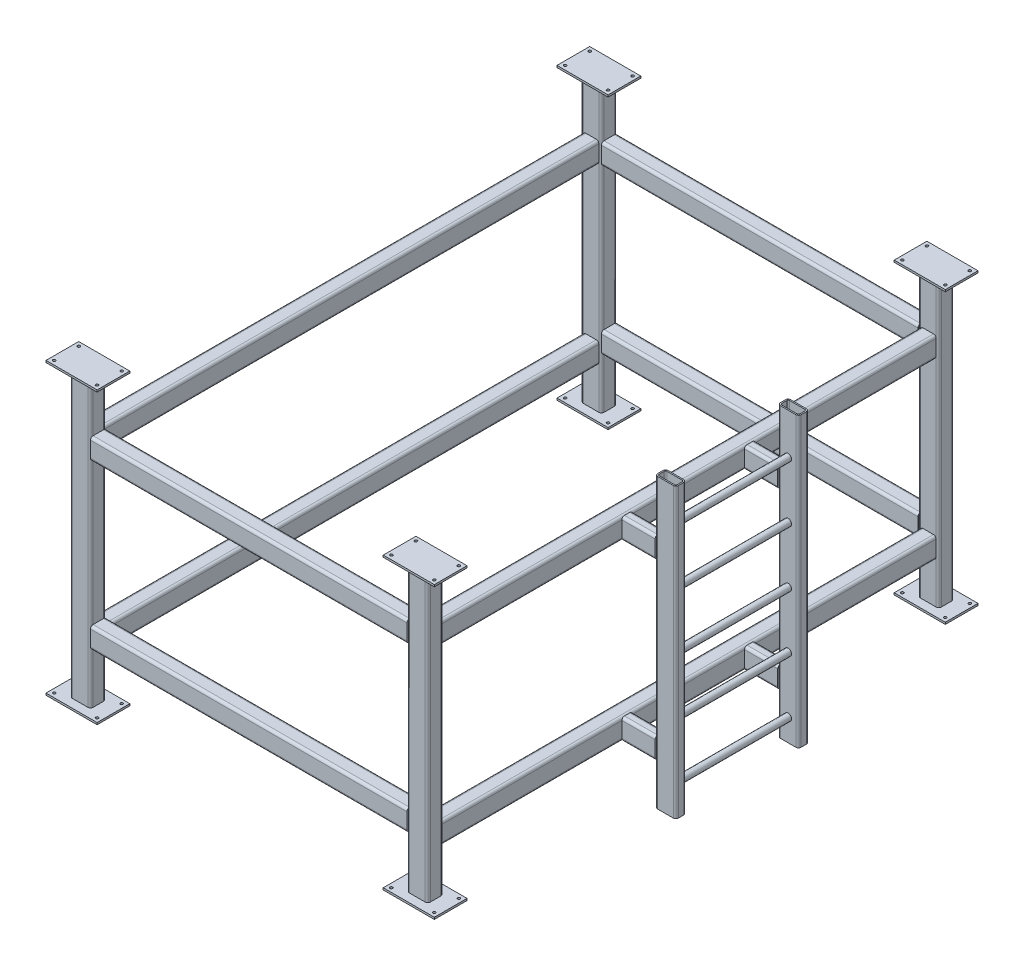
from build123d import *

# Parameters (mm, degrees)
RECTANGULAR_TUBE_4_X_3_X_0_25_1_DEPTH   = 1400
RECTANGULAR_TUBE_4_X_3_X_0_25_1_2_DEPTH = 1400
RECTANGULAR_TUBE_4_X_3_X_0_25_1_3_DEPTH = 1400
RECTANGULAR_TUBE_4_X_3_X_0_25_1_4_DEPTH = 1400
RECTANGULAR_TUBE_4_X_3_X_0_25_2_DEPTH   = 2500
RECTANGULAR_TUBE_4_X_3_X_0_25_2_2_DEPTH = 2500
RECTANGULAR_TUBE_4_X_3_X_0_25_2_3_DEPTH = 2500
RECTANGULAR_TUBE_4_X_3_X_0_25_2_4_DEPTH = 2500
RECTANGULAR_TUBE_4_X_3_X_0_25_3_DEPTH   = 1548.4
RECTANGULAR_TUBE_4_X_3_X_0_25_3_2_DEPTH = 1548.4
RECTANGULAR_TUBE_4_X_3_X_0_25_3_3_DEPTH = 1548.4
RECTANGULAR_TUBE_4_X_3_X_0_25_3_4_DEPTH = 1548.4
SKETCH16_W                              = 250
SKETCH16_H                              = 160
SKETCH16_R                              = 6.5
BOSS_EXTRUDE1_DEPTH                     = 9.525
BOSS_EXTRUDE1_2_DEPTH                   = 9.525
BOSS_EXTRUDE1_3_DEPTH                   = 9.525
BOSS_EXTRUDE1_4_DEPTH                   = 9.525
RECTANGULAR_TUBE_4_X_2_X_0_25_1_DEPTH   = 214.30484978
RECTANGULAR_TUBE_4_X_2_X_0_25_1_2_DEPTH = 214.30484978
RECTANGULAR_TUBE_4_X_2_X_0_25_1_3_DEPTH = 214.30484978
RECTANGULAR_TUBE_4_X_2_X_0_25_1_4_DEPTH = 214.30484978
RECTANGULAR_TUBE_4_X_2_X_0_25_1_5_DEPTH = 1409.53
RECTANGULAR_TUBE_4_X_2_X_0_25_1_6_DEPTH = 1409.53
SKETCH114_R                             = 16.7005
SKETCH114_R_2                           = 13.3223
PIPE_1_0_SCH_40_1_DEPTH                 = 549.200043942
SKETCH114_ON_SEGMENT_2_R                = 16.7005
SKETCH114_ON_SEGMENT_2_R_2              = 13.3223
PIPE_1_0_SCH_40_1_2_DEPTH               = 549.200043942
SKETCH114_ON_SEGMENT_3_R                = 16.7005
SKETCH114_ON_SEGMENT_3_R_2              = 13.3223
PIPE_1_0_SCH_40_1_3_DEPTH               = 549.200043942
SKETCH114_ON_SEGMENT_4_R                = 16.7005
SKETCH114_ON_SEGMENT_4_R_2              = 13.3223
PIPE_1_0_SCH_40_1_4_DEPTH               = 549.200043942
SKETCH114_ON_SEGMENT_5_R                = 16.7005
SKETCH114_ON_SEGMENT_5_R_2              = 13.3223
PIPE_1_0_SCH_40_1_5_DEPTH               = 549.200043942


with BuildPart() as part:
    # Sketch13 → Rectangular tube 4 X 3 X 0.25(1) (new body)
    with BuildSketch(Plane(origin=(-825, 0, 1250), x_dir=(0, 0, -1), z_dir=(0, 1, 0))):
        with BuildLine():
            Line((-25.4, -50.8), (25.4, -50.8))
            ThreePointArc((25.4, -50.8), (34.380256121, -47.080256121), (38.1, -38.1))
            Line((38.1, -38.1), (38.1, 38.1))
            ThreePointArc((38.1, 38.1), (34.380256121, 47.080256121), (25.4, 50.8))
            Line((25.4, 50.8), (-25.4, 50.8))
            ThreePointArc((-25.4, 50.8), (-34.380256121, 47.080256121), (-38.1, 38.1))
            Line((-38.1, 38.1), (-38.1, -38.1))
            ThreePointArc((-38.1, -38.1), (-34.380256121, -47.080256121), (-25.4, -50.8))
        make_face()
        with BuildLine():
            Line((-25.4, -44.45), (25.4, -44.45))
            ThreePointArc((25.4, -44.45), (29.890128061, -42.590128061), (31.75, -38.1))
            Line((31.75, -38.1), (31.75, 38.1))
            ThreePointArc((31.75, 38.1), (29.890128061, 42.590128061), (25.4, 44.45))
            Line((25.4, 44.45), (-25.4, 44.45))
            ThreePointArc((-25.4, 44.45), (-29.890128061, 42.590128061), (-31.75, 38.1))
            Line((-31.75, 38.1), (-31.75, -38.1))
            ThreePointArc((-31.75, -38.1), (-29.890128061, -42.590128061), (-25.4, -44.45))
        make_face(mode=Mode.SUBTRACT)
    extrude(amount=RECTANGULAR_TUBE_4_X_3_X_0_25_1_DEPTH)


with BuildPart() as body_2:
    # Sketch13 on segment 2 (carried to segment 2) → Rectangular tube 4 X 3 X 0.25_1 2 (new body)
    with BuildSketch(Plane(origin=(825, 0, 1250), x_dir=(0, 0, -1), z_dir=(0, 1, 0))):
        with BuildLine():
            Line((-25.4, -50.8), (25.4, -50.8))
            ThreePointArc((25.4, -50.8), (34.380256121, -47.080256121), (38.1, -38.1))
            Line((38.1, -38.1), (38.1, 38.1))
            ThreePointArc((38.1, 38.1), (34.380256121, 47.080256121), (25.4, 50.8))
            Line((25.4, 50.8), (-25.4, 50.8))
            ThreePointArc((-25.4, 50.8), (-34.380256121, 47.080256121), (-38.1, 38.1))
            Line((-38.1, 38.1), (-38.1, -38.1))
            ThreePointArc((-38.1, -38.1), (-34.380256121, -47.080256121), (-25.4, -50.8))
        make_face()
        with BuildLine():
            Line((-25.4, -44.45), (25.4, -44.45))
            ThreePointArc((25.4, -44.45), (29.890128061, -42.590128061), (31.75, -38.1))
            Line((31.75, -38.1), (31.75, 38.1))
            ThreePointArc((31.75, 38.1), (29.890128061, 42.590128061), (25.4, 44.45))
            Line((25.4, 44.45), (-25.4, 44.45))
            ThreePointArc((-25.4, 44.45), (-29.890128061, 42.590128061), (-31.75, 38.1))
            Line((-31.75, 38.1), (-31.75, -38.1))
            ThreePointArc((-31.75, -38.1), (-29.890128061, -42.590128061), (-25.4, -44.45))
        make_face(mode=Mode.SUBTRACT)
    extrude(amount=RECTANGULAR_TUBE_4_X_3_X_0_25_1_2_DEPTH)


with BuildPart() as body_3:
    # Sketch13 on segment 3 (carried to segment 3) → Rectangular tube 4 X 3 X 0.25_1 3 (new body)
    with BuildSketch(Plane(origin=(825, 0, -1250), x_dir=(0, 0, -1), z_dir=(0, 1, 0))):
        with BuildLine():
            Line((-25.4, -50.8), (25.4, -50.8))
            ThreePointArc((25.4, -50.8), (34.380256121, -47.080256121), (38.1, -38.1))
            Line((38.1, -38.1), (38.1, 38.1))
            ThreePointArc((38.1, 38.1), (34.380256121, 47.080256121), (25.4, 50.8))
            Line((25.4, 50.8), (-25.4, 50.8))
            ThreePointArc((-25.4, 50.8), (-34.380256121, 47.080256121), (-38.1, 38.1))
            Line((-38.1, 38.1), (-38.1, -38.1))
            ThreePointArc((-38.1, -38.1), (-34.380256121, -47.080256121), (-25.4, -50.8))
        make_face()
        with BuildLine():
            Line((-25.4, -44.45), (25.4, -44.45))
            ThreePointArc((25.4, -44.45), (29.890128061, -42.590128061), (31.75, -38.1))
            Line((31.75, -38.1), (31.75, 38.1))
            ThreePointArc((31.75, 38.1), (29.890128061, 42.590128061), (25.4, 44.45))
            Line((25.4, 44.45), (-25.4, 44.45))
            ThreePointArc((-25.4, 44.45), (-29.890128061, 42.590128061), (-31.75, 38.1))
            Line((-31.75, 38.1), (-31.75, -38.1))
            ThreePointArc((-31.75, -38.1), (-29.890128061, -42.590128061), (-25.4, -44.45))
        make_face(mode=Mode.SUBTRACT)
    extrude(amount=RECTANGULAR_TUBE_4_X_3_X_0_25_1_3_DEPTH)


with BuildPart() as body_4:
    # Sketch13 on segment 4 (carried to segment 4) → Rectangular tube 4 X 3 X 0.25_1 4 (new body)
    with BuildSketch(Plane(origin=(-825, 0, -1250), x_dir=(0, 0, -1), z_dir=(0, 1, 0))):
        with BuildLine():
            Line((-25.4, -50.8), (25.4, -50.8))
            ThreePointArc((25.4, -50.8), (34.380256121, -47.080256121), (38.1, -38.1))
            Line((38.1, -38.1), (38.1, 38.1))
            ThreePointArc((38.1, 38.1), (34.380256121, 47.080256121), (25.4, 50.8))
            Line((25.4, 50.8), (-25.4, 50.8))
            ThreePointArc((-25.4, 50.8), (-34.380256121, 47.080256121), (-38.1, 38.1))
            Line((-38.1, 38.1), (-38.1, -38.1))
            ThreePointArc((-38.1, -38.1), (-34.380256121, -47.080256121), (-25.4, -50.8))
        make_face()
        with BuildLine():
            Line((-25.4, -44.45), (25.4, -44.45))
            ThreePointArc((25.4, -44.45), (29.890128061, -42.590128061), (31.75, -38.1))
            Line((31.75, -38.1), (31.75, 38.1))
            ThreePointArc((31.75, 38.1), (29.890128061, 42.590128061), (25.4, 44.45))
            Line((25.4, 44.45), (-25.4, 44.45))
            ThreePointArc((-25.4, 44.45), (-29.890128061, 42.590128061), (-31.75, 38.1))
            Line((-31.75, 38.1), (-31.75, -38.1))
            ThreePointArc((-31.75, -38.1), (-29.890128061, -42.590128061), (-25.4, -44.45))
        make_face(mode=Mode.SUBTRACT)
    extrude(amount=RECTANGULAR_TUBE_4_X_3_X_0_25_1_4_DEPTH)


with BuildPart() as body_5:
    # Sketch14 → Rectangular tube 4 X 3 X 0.25(2) (new body)
    with BuildSketch(Plane(origin=(-825, 1100, 1250), x_dir=(1, 0, 0), z_dir=(0, 0, -1))):
        with BuildLine():
            Line((-25.4, -50.8), (25.4, -50.8))
            ThreePointArc((25.4, -50.8), (34.380256121, -47.080256121), (38.1, -38.1))
            Line((38.1, -38.1), (38.1, 38.1))
            ThreePointArc((38.1, 38.1), (34.380256121, 47.080256121), (25.4, 50.8))
            Line((25.4, 50.8), (-25.4, 50.8))
            ThreePointArc((-25.4, 50.8), (-34.380256121, 47.080256121), (-38.1, 38.1))
            Line((-38.1, 38.1), (-38.1, -38.1))
            ThreePointArc((-38.1, -38.1), (-34.380256121, -47.080256121), (-25.4, -50.8))
        make_face()
        with BuildLine():
            Line((-25.4, -44.45), (25.4, -44.45))
            ThreePointArc((25.4, -44.45), (29.890128061, -42.590128061), (31.75, -38.1))
            Line((31.75, -38.1), (31.75, 38.1))
            ThreePointArc((31.75, 38.1), (29.890128061, 42.590128061), (25.4, 44.45))
            Line((25.4, 44.45), (-25.4, 44.45))
            ThreePointArc((-25.4, 44.45), (-29.890128061, 42.590128061), (-31.75, 38.1))
            Line((-31.75, 38.1), (-31.75, -38.1))
            ThreePointArc((-31.75, -38.1), (-29.890128061, -42.590128061), (-25.4, -44.45))
        make_face(mode=Mode.SUBTRACT)
    extrude(amount=RECTANGULAR_TUBE_4_X_3_X_0_25_2_DEPTH)

    # Trim/Extend1
    split(bisect_by=Plane(origin=(-825, 700, -1211.9), x_dir=(0, -1, 0), z_dir=(0, 0, 1)), keep=Keep.TOP)

    # Trim_Extend1 5
    split(bisect_by=Plane(origin=(-825, 700, 1211.9), x_dir=(0, 1, 0), z_dir=(0, 0, -1)), keep=Keep.TOP)


with BuildPart() as body_6:
    # Sketch14 on segment 2 (carried to segment 2) → Rectangular tube 4 X 3 X 0.25_2 2 (new body)
    with BuildSketch(Plane(origin=(-825, 250, 1250), x_dir=(1, 0, 0), z_dir=(0, 0, -1))):
        with BuildLine():
            Line((-25.4, -50.8), (25.4, -50.8))
            ThreePointArc((25.4, -50.8), (34.380256121, -47.080256121), (38.1, -38.1))
            Line((38.1, -38.1), (38.1, 38.1))
            ThreePointArc((38.1, 38.1), (34.380256121, 47.080256121), (25.4, 50.8))
            Line((25.4, 50.8), (-25.4, 50.8))
            ThreePointArc((-25.4, 50.8), (-34.380256121, 47.080256121), (-38.1, 38.1))
            Line((-38.1, 38.1), (-38.1, -38.1))
            ThreePointArc((-38.1, -38.1), (-34.380256121, -47.080256121), (-25.4, -50.8))
        make_face()
        with BuildLine():
            Line((-25.4, -44.45), (25.4, -44.45))
            ThreePointArc((25.4, -44.45), (29.890128061, -42.590128061), (31.75, -38.1))
            Line((31.75, -38.1), (31.75, 38.1))
            ThreePointArc((31.75, 38.1), (29.890128061, 42.590128061), (25.4, 44.45))
            Line((25.4, 44.45), (-25.4, 44.45))
            ThreePointArc((-25.4, 44.45), (-29.890128061, 42.590128061), (-31.75, 38.1))
            Line((-31.75, 38.1), (-31.75, -38.1))
            ThreePointArc((-31.75, -38.1), (-29.890128061, -42.590128061), (-25.4, -44.45))
        make_face(mode=Mode.SUBTRACT)
    extrude(amount=RECTANGULAR_TUBE_4_X_3_X_0_25_2_2_DEPTH)

    # Trim/Extend1
    split(bisect_by=Plane(origin=(-825, 700, -1211.9), x_dir=(0, -1, 0), z_dir=(0, 0, 1)), keep=Keep.TOP)

    # Trim_Extend1 5
    split(bisect_by=Plane(origin=(-825, 700, 1211.9), x_dir=(0, 1, 0), z_dir=(0, 0, -1)), keep=Keep.TOP)


with BuildPart() as body_7:
    # Sketch14 on segment 3 (carried to segment 3) → Rectangular tube 4 X 3 X 0.25_2 3 (new body)
    with BuildSketch(Plane(origin=(825, 1100, 1250), x_dir=(1, 0, 0), z_dir=(0, 0, -1))):
        with BuildLine():
            Line((-25.4, -50.8), (25.4, -50.8))
            ThreePointArc((25.4, -50.8), (34.380256121, -47.080256121), (38.1, -38.1))
            Line((38.1, -38.1), (38.1, 38.1))
            ThreePointArc((38.1, 38.1), (34.380256121, 47.080256121), (25.4, 50.8))
            Line((25.4, 50.8), (-25.4, 50.8))
            ThreePointArc((-25.4, 50.8), (-34.380256121, 47.080256121), (-38.1, 38.1))
            Line((-38.1, 38.1), (-38.1, -38.1))
            ThreePointArc((-38.1, -38.1), (-34.380256121, -47.080256121), (-25.4, -50.8))
        make_face()
        with BuildLine():
            Line((-25.4, -44.45), (25.4, -44.45))
            ThreePointArc((25.4, -44.45), (29.890128061, -42.590128061), (31.75, -38.1))
            Line((31.75, -38.1), (31.75, 38.1))
            ThreePointArc((31.75, 38.1), (29.890128061, 42.590128061), (25.4, 44.45))
            Line((25.4, 44.45), (-25.4, 44.45))
            ThreePointArc((-25.4, 44.45), (-29.890128061, 42.590128061), (-31.75, 38.1))
            Line((-31.75, 38.1), (-31.75, -38.1))
            ThreePointArc((-31.75, -38.1), (-29.890128061, -42.590128061), (-25.4, -44.45))
        make_face(mode=Mode.SUBTRACT)
    extrude(amount=RECTANGULAR_TUBE_4_X_3_X_0_25_2_3_DEPTH)

    # Trim/Extend1
    split(bisect_by=Plane(origin=(-825, 700, -1211.9), x_dir=(0, -1, 0), z_dir=(0, 0, 1)), keep=Keep.TOP)

    # Trim_Extend1 5
    split(bisect_by=Plane(origin=(-825, 700, 1211.9), x_dir=(0, 1, 0), z_dir=(0, 0, -1)), keep=Keep.TOP)


with BuildPart() as body_8:
    # Sketch14 on segment 4 (carried to segment 4) → Rectangular tube 4 X 3 X 0.25_2 4 (new body)
    with BuildSketch(Plane(origin=(825, 250, 1250), x_dir=(1, 0, 0), z_dir=(0, 0, -1))):
        with BuildLine():
            Line((-25.4, -50.8), (25.4, -50.8))
            ThreePointArc((25.4, -50.8), (34.380256121, -47.080256121), (38.1, -38.1))
            Line((38.1, -38.1), (38.1, 38.1))
            ThreePointArc((38.1, 38.1), (34.380256121, 47.080256121), (25.4, 50.8))
            Line((25.4, 50.8), (-25.4, 50.8))
            ThreePointArc((-25.4, 50.8), (-34.380256121, 47.080256121), (-38.1, 38.1))
            Line((-38.1, 38.1), (-38.1, -38.1))
            ThreePointArc((-38.1, -38.1), (-34.380256121, -47.080256121), (-25.4, -50.8))
        make_face()
        with BuildLine():
            Line((-25.4, -44.45), (25.4, -44.45))
            ThreePointArc((25.4, -44.45), (29.890128061, -42.590128061), (31.75, -38.1))
            Line((31.75, -38.1), (31.75, 38.1))
            ThreePointArc((31.75, 38.1), (29.890128061, 42.590128061), (25.4, 44.45))
            Line((25.4, 44.45), (-25.4, 44.45))
            ThreePointArc((-25.4, 44.45), (-29.890128061, 42.590128061), (-31.75, 38.1))
            Line((-31.75, 38.1), (-31.75, -38.1))
            ThreePointArc((-31.75, -38.1), (-29.890128061, -42.590128061), (-25.4, -44.45))
        make_face(mode=Mode.SUBTRACT)
    extrude(amount=RECTANGULAR_TUBE_4_X_3_X_0_25_2_4_DEPTH)

    # Trim/Extend1
    split(bisect_by=Plane(origin=(-825, 700, -1211.9), x_dir=(0, -1, 0), z_dir=(0, 0, 1)), keep=Keep.TOP)

    # Trim_Extend1 5
    split(bisect_by=Plane(origin=(-825, 700, 1211.9), x_dir=(0, 1, 0), z_dir=(0, 0, -1)), keep=Keep.TOP)


with BuildPart() as body_9:
    # Sketch15 → Rectangular tube 4 X 3 X 0.25(3) (new body)
    with BuildSketch(Plane(origin=(774.2, 1100, 1250), x_dir=(0, 0, 1), z_dir=(-1, 0, 0))):
        with BuildLine():
            Line((-25.4, -50.8), (25.4, -50.8))
            ThreePointArc((25.4, -50.8), (34.380256121, -47.080256121), (38.1, -38.1))
            Line((38.1, -38.1), (38.1, 38.1))
            ThreePointArc((38.1, 38.1), (34.380256121, 47.080256121), (25.4, 50.8))
            Line((25.4, 50.8), (-25.4, 50.8))
            ThreePointArc((-25.4, 50.8), (-34.380256121, 47.080256121), (-38.1, 38.1))
            Line((-38.1, 38.1), (-38.1, -38.1))
            ThreePointArc((-38.1, -38.1), (-34.380256121, -47.080256121), (-25.4, -50.8))
        make_face()
        with BuildLine():
            Line((-25.4, -44.45), (25.4, -44.45))
            ThreePointArc((25.4, -44.45), (29.890128061, -42.590128061), (31.75, -38.1))
            Line((31.75, -38.1), (31.75, 38.1))
            ThreePointArc((31.75, 38.1), (29.890128061, 42.590128061), (25.4, 44.45))
            Line((25.4, 44.45), (-25.4, 44.45))
            ThreePointArc((-25.4, 44.45), (-29.890128061, 42.590128061), (-31.75, 38.1))
            Line((-31.75, 38.1), (-31.75, -38.1))
            ThreePointArc((-31.75, -38.1), (-29.890128061, -42.590128061), (-25.4, -44.45))
        make_face(mode=Mode.SUBTRACT)
    extrude(amount=RECTANGULAR_TUBE_4_X_3_X_0_25_3_DEPTH)


with BuildPart() as body_10:
    # Sketch15 on segment 2 (carried to segment 2) → Rectangular tube 4 X 3 X 0.25_3 2 (new body)
    with BuildSketch(Plane(origin=(774.2, 300, 1250), x_dir=(0, 0, 1), z_dir=(-1, 0, 0))):
        with BuildLine():
            Line((-25.4, -50.8), (25.4, -50.8))
            ThreePointArc((25.4, -50.8), (34.380256121, -47.080256121), (38.1, -38.1))
            Line((38.1, -38.1), (38.1, 38.1))
            ThreePointArc((38.1, 38.1), (34.380256121, 47.080256121), (25.4, 50.8))
            Line((25.4, 50.8), (-25.4, 50.8))
            ThreePointArc((-25.4, 50.8), (-34.380256121, 47.080256121), (-38.1, 38.1))
            Line((-38.1, 38.1), (-38.1, -38.1))
            ThreePointArc((-38.1, -38.1), (-34.380256121, -47.080256121), (-25.4, -50.8))
        make_face()
        with BuildLine():
            Line((-25.4, -44.45), (25.4, -44.45))
            ThreePointArc((25.4, -44.45), (29.890128061, -42.590128061), (31.75, -38.1))
            Line((31.75, -38.1), (31.75, 38.1))
            ThreePointArc((31.75, 38.1), (29.890128061, 42.590128061), (25.4, 44.45))
            Line((25.4, 44.45), (-25.4, 44.45))
            ThreePointArc((-25.4, 44.45), (-29.890128061, 42.590128061), (-31.75, 38.1))
            Line((-31.75, 38.1), (-31.75, -38.1))
            ThreePointArc((-31.75, -38.1), (-29.890128061, -42.590128061), (-25.4, -44.45))
        make_face(mode=Mode.SUBTRACT)
    extrude(amount=RECTANGULAR_TUBE_4_X_3_X_0_25_3_2_DEPTH)


with BuildPart() as body_11:
    # Sketch15 on segment 3 (carried to segment 3) → Rectangular tube 4 X 3 X 0.25_3 3 (new body)
    with BuildSketch(Plane(origin=(774.2, 300, -1250), x_dir=(0, 0, 1), z_dir=(-1, 0, 0))):
        with BuildLine():
            Line((-25.4, -50.8), (25.4, -50.8))
            ThreePointArc((25.4, -50.8), (34.380256121, -47.080256121), (38.1, -38.1))
            Line((38.1, -38.1), (38.1, 38.1))
            ThreePointArc((38.1, 38.1), (34.380256121, 47.080256121), (25.4, 50.8))
            Line((25.4, 50.8), (-25.4, 50.8))
            ThreePointArc((-25.4, 50.8), (-34.380256121, 47.080256121), (-38.1, 38.1))
            Line((-38.1, 38.1), (-38.1, -38.1))
            ThreePointArc((-38.1, -38.1), (-34.380256121, -47.080256121), (-25.4, -50.8))
        make_face()
        with BuildLine():
            Line((-25.4, -44.45), (25.4, -44.45))
            ThreePointArc((25.4, -44.45), (29.890128061, -42.590128061), (31.75, -38.1))
            Line((31.75, -38.1), (31.75, 38.1))
            ThreePointArc((31.75, 38.1), (29.890128061, 42.590128061), (25.4, 44.45))
            Line((25.4, 44.45), (-25.4, 44.45))
            ThreePointArc((-25.4, 44.45), (-29.890128061, 42.590128061), (-31.75, 38.1))
            Line((-31.75, 38.1), (-31.75, -38.1))
            ThreePointArc((-31.75, -38.1), (-29.890128061, -42.590128061), (-25.4, -44.45))
        make_face(mode=Mode.SUBTRACT)
    extrude(amount=RECTANGULAR_TUBE_4_X_3_X_0_25_3_3_DEPTH)


with BuildPart() as body_12:
    # Sketch15 on segment 4 (carried to segment 4) → Rectangular tube 4 X 3 X 0.25_3 4 (new body)
    with BuildSketch(Plane(origin=(774.2, 1100, -1250), x_dir=(0, 0, 1), z_dir=(-1, 0, 0))):
        with BuildLine():
            Line((-25.4, -50.8), (25.4, -50.8))
            ThreePointArc((25.4, -50.8), (34.380256121, -47.080256121), (38.1, -38.1))
            Line((38.1, -38.1), (38.1, 38.1))
            ThreePointArc((38.1, 38.1), (34.380256121, 47.080256121), (25.4, 50.8))
            Line((25.4, 50.8), (-25.4, 50.8))
            ThreePointArc((-25.4, 50.8), (-34.380256121, 47.080256121), (-38.1, 38.1))
            Line((-38.1, 38.1), (-38.1, -38.1))
            ThreePointArc((-38.1, -38.1), (-34.380256121, -47.080256121), (-25.4, -50.8))
        make_face()
        with BuildLine():
            Line((-25.4, -44.45), (25.4, -44.45))
            ThreePointArc((25.4, -44.45), (29.890128061, -42.590128061), (31.75, -38.1))
            Line((31.75, -38.1), (31.75, 38.1))
            ThreePointArc((31.75, 38.1), (29.890128061, 42.590128061), (25.4, 44.45))
            Line((25.4, 44.45), (-25.4, 44.45))
            ThreePointArc((-25.4, 44.45), (-29.890128061, 42.590128061), (-31.75, 38.1))
            Line((-31.75, 38.1), (-31.75, -38.1))
            ThreePointArc((-31.75, -38.1), (-29.890128061, -42.590128061), (-25.4, -44.45))
        make_face(mode=Mode.SUBTRACT)
    extrude(amount=RECTANGULAR_TUBE_4_X_3_X_0_25_3_4_DEPTH)


with BuildPart() as body_13:
    # Sketch16 → Boss-Extrude1 (new body)
    with BuildSketch(Plane(origin=(0, 1400, 0), x_dir=(1, 0, 0), z_dir=(0, 1, 0))):
        with Locations((-825, -1250)):
            Rectangle(SKETCH16_W, SKETCH16_H)
        with Locations(Location((-930, -1190, 0), (0, 0, 90))):
            Circle(SKETCH16_R, mode=Mode.SUBTRACT)
        with Locations(Location((-720, -1190, 0), (0, 0, 90))):
            Circle(SKETCH16_R, mode=Mode.SUBTRACT)
        with Locations(Location((-720, -1310, 0), (0, 0, 90))):
            Circle(SKETCH16_R, mode=Mode.SUBTRACT)
        with Locations(Location((-930, -1310, 0), (0, 0, 90))):
            Circle(SKETCH16_R, mode=Mode.SUBTRACT)
    boss_extrude1 = extrude(amount=BOSS_EXTRUDE1_DEPTH)


with BuildPart() as body_14:
    # Sketch16 → Boss-Extrude1 2 (new body)
    with BuildSketch(Plane(origin=(0, 1400, 0), x_dir=(1, 0, 0), z_dir=(0, 1, 0))):
        with Locations((825, -1250)):
            Rectangle(SKETCH16_W, SKETCH16_H)
        with Locations(Location((930, -1310, 0), (0, 0, 90))):
            Circle(SKETCH16_R, mode=Mode.SUBTRACT)
        with Locations(Location((720, -1310, 0), (0, 0, 90))):
            Circle(SKETCH16_R, mode=Mode.SUBTRACT)
        with Locations(Location((720, -1190, 0), (0, 0, 90))):
            Circle(SKETCH16_R, mode=Mode.SUBTRACT)
        with Locations(Location((930, -1190, 0), (0, 0, 90))):
            Circle(SKETCH16_R, mode=Mode.SUBTRACT)
    boss_extrude1_2 = extrude(amount=BOSS_EXTRUDE1_2_DEPTH)


with BuildPart() as body_15:
    # Sketch16 → Boss-Extrude1 3 (new body)
    with BuildSketch(Plane(origin=(0, 1400, 0), x_dir=(1, 0, 0), z_dir=(0, 1, 0))):
        with Locations((825, 1250)):
            Rectangle(SKETCH16_W, SKETCH16_H)
        with Locations(Location((930, 1190, 0), (0, 0, 90))):
            Circle(SKETCH16_R, mode=Mode.SUBTRACT)
        with Locations(Location((720, 1190, 0), (0, 0, 90))):
            Circle(SKETCH16_R, mode=Mode.SUBTRACT)
        with Locations(Location((720, 1310, 0), (0, 0, 90))):
            Circle(SKETCH16_R, mode=Mode.SUBTRACT)
        with Locations(Location((930, 1310, 0), (0, 0, 90))):
            Circle(SKETCH16_R, mode=Mode.SUBTRACT)
    boss_extrude1_3 = extrude(amount=BOSS_EXTRUDE1_3_DEPTH)


with BuildPart() as body_16:
    # Sketch16 → Boss-Extrude1 4 (new body)
    with BuildSketch(Plane(origin=(0, 1400, 0), x_dir=(1, 0, 0), z_dir=(0, 1, 0))):
        with Locations((-825, 1250)):
            Rectangle(SKETCH16_W, SKETCH16_H)
        with Locations(Location((-930, 1310, 0), (0, 0, 90))):
            Circle(SKETCH16_R, mode=Mode.SUBTRACT)
        with Locations(Location((-720, 1310, 0), (0, 0, 90))):
            Circle(SKETCH16_R, mode=Mode.SUBTRACT)
        with Locations(Location((-720, 1190, 0), (0, 0, 90))):
            Circle(SKETCH16_R, mode=Mode.SUBTRACT)
        with Locations(Location((-930, 1190, 0), (0, 0, 90))):
            Circle(SKETCH16_R, mode=Mode.SUBTRACT)
    boss_extrude1_4 = extrude(amount=BOSS_EXTRUDE1_4_DEPTH)


with BuildPart() as part_1:
    add(part.part)

    add(body_2.part)  # Mirror1 merges body 2

    add(body_3.part)  # Mirror1 merges body 3

    add(body_4.part)  # Mirror1 merges body 4
    # Mirror1: Boss-Extrude1, Boss-Extrude1 2, Boss-Extrude1 3, Boss-Extrude1 4 across plane
    add(boss_extrude1.mirror(Plane(origin=(0, 700, 0), x_dir=(0, 0, 1), z_dir=(0, -1, 0))))
    add(boss_extrude1_2.mirror(Plane(origin=(0, 700, 0), x_dir=(0, 0, 1), z_dir=(0, -1, 0))))
    add(boss_extrude1_3.mirror(Plane(origin=(0, 700, 0), x_dir=(0, 0, 1), z_dir=(0, -1, 0))))
    add(boss_extrude1_4.mirror(Plane(origin=(0, 700, 0), x_dir=(0, 0, 1), z_dir=(0, -1, 0))))


with BuildPart() as body_14_2:
    # Sketch113 → Rectangular tube 4 X 2 X 0.25(1) (new body)
    with BuildSketch(Plane(origin=(863.1, 1100, 300), x_dir=(0, 0, -1), z_dir=(1, 0, 0))):
        with BuildLine():
            Line((-12.699978029, -50.8), (12.699978029, -50.8))
            ThreePointArc((12.699978029, -50.8), (21.68023415, -47.080256121), (25.399978029, -38.1))
            Line((25.399978029, -38.1), (25.399978029, 38.1))
            ThreePointArc((25.399978029, 38.1), (21.68023415, 47.080256121), (12.699978029, 50.8))
            Line((12.699978029, 50.8), (-12.699978029, 50.8))
            ThreePointArc((-12.699978029, 50.8), (-21.68023415, 47.080256121), (-25.399978029, 38.1))
            Line((-25.399978029, 38.1), (-25.399978029, -38.1))
            ThreePointArc((-25.399978029, -38.1), (-21.68023415, -47.080256121), (-12.699978029, -50.8))
        make_face()
        with BuildLine():
            Line((-12.699978029, -44.45), (12.699978029, -44.45))
            ThreePointArc((12.699978029, -44.45), (17.19010609, -42.590128061), (19.049978029, -38.1))
            Line((19.049978029, -38.1), (19.049978029, 38.1))
            ThreePointArc((19.049978029, 38.1), (17.19010609, 42.590128061), (12.699978029, 44.45))
            Line((12.699978029, 44.45), (-12.699978029, 44.45))
            ThreePointArc((-12.699978029, 44.45), (-17.19010609, 42.590128061), (-19.049978029, 38.1))
            Line((-19.049978029, 38.1), (-19.049978029, -38.1))
            ThreePointArc((-19.049978029, -38.1), (-17.19010609, -42.590128061), (-12.699978029, -44.45))
        make_face(mode=Mode.SUBTRACT)
    extrude(amount=RECTANGULAR_TUBE_4_X_2_X_0_25_1_DEPTH)

    # Rectangular tube 4 X 2 X 0.25(1) end butt
    split(bisect_by=Plane(origin=(1025.60484978, 1100, 300), x_dir=(0, -1, 0), z_dir=(-1, 0, 0)), keep=Keep.TOP)


with BuildPart() as body_15_2:
    # Sketch113 on segment 2 (carried to segment 2) → Rectangular tube 4 X 2 X 0.25_1 2 (new body)
    with BuildSketch(Plane(origin=(863.1, 1100, -300), x_dir=(0, 0, -1), z_dir=(1, 0, 0))):
        with BuildLine():
            Line((-12.699978029, -50.8), (12.699978029, -50.8))
            ThreePointArc((12.699978029, -50.8), (21.68023415, -47.080256121), (25.399978029, -38.1))
            Line((25.399978029, -38.1), (25.399978029, 38.1))
            ThreePointArc((25.399978029, 38.1), (21.68023415, 47.080256121), (12.699978029, 50.8))
            Line((12.699978029, 50.8), (-12.699978029, 50.8))
            ThreePointArc((-12.699978029, 50.8), (-21.68023415, 47.080256121), (-25.399978029, 38.1))
            Line((-25.399978029, 38.1), (-25.399978029, -38.1))
            ThreePointArc((-25.399978029, -38.1), (-21.68023415, -47.080256121), (-12.699978029, -50.8))
        make_face()
        with BuildLine():
            Line((-12.699978029, -44.45), (12.699978029, -44.45))
            ThreePointArc((12.699978029, -44.45), (17.19010609, -42.590128061), (19.049978029, -38.1))
            Line((19.049978029, -38.1), (19.049978029, 38.1))
            ThreePointArc((19.049978029, 38.1), (17.19010609, 42.590128061), (12.699978029, 44.45))
            Line((12.699978029, 44.45), (-12.699978029, 44.45))
            ThreePointArc((-12.699978029, 44.45), (-17.19010609, 42.590128061), (-19.049978029, 38.1))
            Line((-19.049978029, 38.1), (-19.049978029, -38.1))
            ThreePointArc((-19.049978029, -38.1), (-17.19010609, -42.590128061), (-12.699978029, -44.45))
        make_face(mode=Mode.SUBTRACT)
    extrude(amount=RECTANGULAR_TUBE_4_X_2_X_0_25_1_2_DEPTH)

    # Rectangular tube 4 X 2 X 0.25_1 2 end bu
    split(bisect_by=Plane(origin=(1025.60484978, 1100, -300), x_dir=(0, -1, 0), z_dir=(-1, 0, 0)), keep=Keep.TOP)


with BuildPart() as body_16_2:
    # Sketch113 on segment 3 (carried to segment 3) → Rectangular tube 4 X 2 X 0.25_1 3 (new body)
    with BuildSketch(Plane(origin=(863.1, 250, -300), x_dir=(0, 0, -1), z_dir=(1, 0, 0))):
        with BuildLine():
            Line((-12.699978029, -50.8), (12.699978029, -50.8))
            ThreePointArc((12.699978029, -50.8), (21.68023415, -47.080256121), (25.399978029, -38.1))
            Line((25.399978029, -38.1), (25.399978029, 38.1))
            ThreePointArc((25.399978029, 38.1), (21.68023415, 47.080256121), (12.699978029, 50.8))
            Line((12.699978029, 50.8), (-12.699978029, 50.8))
            ThreePointArc((-12.699978029, 50.8), (-21.68023415, 47.080256121), (-25.399978029, 38.1))
            Line((-25.399978029, 38.1), (-25.399978029, -38.1))
            ThreePointArc((-25.399978029, -38.1), (-21.68023415, -47.080256121), (-12.699978029, -50.8))
        make_face()
        with BuildLine():
            Line((-12.699978029, -44.45), (12.699978029, -44.45))
            ThreePointArc((12.699978029, -44.45), (17.19010609, -42.590128061), (19.049978029, -38.1))
            Line((19.049978029, -38.1), (19.049978029, 38.1))
            ThreePointArc((19.049978029, 38.1), (17.19010609, 42.590128061), (12.699978029, 44.45))
            Line((12.699978029, 44.45), (-12.699978029, 44.45))
            ThreePointArc((-12.699978029, 44.45), (-17.19010609, 42.590128061), (-19.049978029, 38.1))
            Line((-19.049978029, 38.1), (-19.049978029, -38.1))
            ThreePointArc((-19.049978029, -38.1), (-17.19010609, -42.590128061), (-12.699978029, -44.45))
        make_face(mode=Mode.SUBTRACT)
    extrude(amount=RECTANGULAR_TUBE_4_X_2_X_0_25_1_3_DEPTH)

    # Rectangular tube 4 X 2 X 0.25_1 3 end bu
    split(bisect_by=Plane(origin=(1025.60484978, 250, -300), x_dir=(0, -1, 0), z_dir=(-1, 0, 0)), keep=Keep.TOP)


with BuildPart() as body_17:
    # Sketch113 on segment 4 (carried to segment 4) → Rectangular tube 4 X 2 X 0.25_1 4 (new body)
    with BuildSketch(Plane(origin=(863.1, 250, 300), x_dir=(0, 0, -1), z_dir=(1, 0, 0))):
        with BuildLine():
            Line((-12.699978029, -50.8), (12.699978029, -50.8))
            ThreePointArc((12.699978029, -50.8), (21.68023415, -47.080256121), (25.399978029, -38.1))
            Line((25.399978029, -38.1), (25.399978029, 38.1))
            ThreePointArc((25.399978029, 38.1), (21.68023415, 47.080256121), (12.699978029, 50.8))
            Line((12.699978029, 50.8), (-12.699978029, 50.8))
            ThreePointArc((-12.699978029, 50.8), (-21.68023415, 47.080256121), (-25.399978029, 38.1))
            Line((-25.399978029, 38.1), (-25.399978029, -38.1))
            ThreePointArc((-25.399978029, -38.1), (-21.68023415, -47.080256121), (-12.699978029, -50.8))
        make_face()
        with BuildLine():
            Line((-12.699978029, -44.45), (12.699978029, -44.45))
            ThreePointArc((12.699978029, -44.45), (17.19010609, -42.590128061), (19.049978029, -38.1))
            Line((19.049978029, -38.1), (19.049978029, 38.1))
            ThreePointArc((19.049978029, 38.1), (17.19010609, 42.590128061), (12.699978029, 44.45))
            Line((12.699978029, 44.45), (-12.699978029, 44.45))
            ThreePointArc((-12.699978029, 44.45), (-17.19010609, 42.590128061), (-19.049978029, 38.1))
            Line((-19.049978029, 38.1), (-19.049978029, -38.1))
            ThreePointArc((-19.049978029, -38.1), (-17.19010609, -42.590128061), (-12.699978029, -44.45))
        make_face(mode=Mode.SUBTRACT)
    extrude(amount=RECTANGULAR_TUBE_4_X_2_X_0_25_1_4_DEPTH)

    # Rectangular tube 4 X 2 X 0.25_1 4 end bu
    split(bisect_by=Plane(origin=(1025.60484978, 250, 300), x_dir=(0, -1, 0), z_dir=(-1, 0, 0)), keep=Keep.TOP)


with BuildPart() as body_18:
    # Sketch113 on segment 5 (carried to segment 5) → Rectangular tube 4 X 2 X 0.25_1 5 (new body)
    with BuildSketch(Plane(origin=(1076.40484978, 1409.53, 300), x_dir=(0, 0, -1), z_dir=(0, -1, 0))):
        with BuildLine():
            Line((-12.699978029, -50.8), (12.699978029, -50.8))
            ThreePointArc((12.699978029, -50.8), (21.68023415, -47.080256121), (25.399978029, -38.1))
            Line((25.399978029, -38.1), (25.399978029, 38.1))
            ThreePointArc((25.399978029, 38.1), (21.68023415, 47.080256121), (12.699978029, 50.8))
            Line((12.699978029, 50.8), (-12.699978029, 50.8))
            ThreePointArc((-12.699978029, 50.8), (-21.68023415, 47.080256121), (-25.399978029, 38.1))
            Line((-25.399978029, 38.1), (-25.399978029, -38.1))
            ThreePointArc((-25.399978029, -38.1), (-21.68023415, -47.080256121), (-12.699978029, -50.8))
        make_face()
        with BuildLine():
            Line((-12.699978029, -44.45), (12.699978029, -44.45))
            ThreePointArc((12.699978029, -44.45), (17.19010609, -42.590128061), (19.049978029, -38.1))
            Line((19.049978029, -38.1), (19.049978029, 38.1))
            ThreePointArc((19.049978029, 38.1), (17.19010609, 42.590128061), (12.699978029, 44.45))
            Line((12.699978029, 44.45), (-12.699978029, 44.45))
            ThreePointArc((-12.699978029, 44.45), (-17.19010609, 42.590128061), (-19.049978029, 38.1))
            Line((-19.049978029, 38.1), (-19.049978029, -38.1))
            ThreePointArc((-19.049978029, -38.1), (-17.19010609, -42.590128061), (-12.699978029, -44.45))
        make_face(mode=Mode.SUBTRACT)
    extrude(amount=RECTANGULAR_TUBE_4_X_2_X_0_25_1_5_DEPTH)


with BuildPart() as body_19:
    # Sketch113 on segment 6 (carried to segment 6) → Rectangular tube 4 X 2 X 0.25_1 6 (new body)
    with BuildSketch(Plane(origin=(1076.40484978, 1409.53, -300), x_dir=(0, 0, -1), z_dir=(0, -1, 0))):
        with BuildLine():
            Line((-12.699978029, -50.8), (12.699978029, -50.8))
            ThreePointArc((12.699978029, -50.8), (21.68023415, -47.080256121), (25.399978029, -38.1))
            Line((25.399978029, -38.1), (25.399978029, 38.1))
            ThreePointArc((25.399978029, 38.1), (21.68023415, 47.080256121), (12.699978029, 50.8))
            Line((12.699978029, 50.8), (-12.699978029, 50.8))
            ThreePointArc((-12.699978029, 50.8), (-21.68023415, 47.080256121), (-25.399978029, 38.1))
            Line((-25.399978029, 38.1), (-25.399978029, -38.1))
            ThreePointArc((-25.399978029, -38.1), (-21.68023415, -47.080256121), (-12.699978029, -50.8))
        make_face()
        with BuildLine():
            Line((-12.699978029, -44.45), (12.699978029, -44.45))
            ThreePointArc((12.699978029, -44.45), (17.19010609, -42.590128061), (19.049978029, -38.1))
            Line((19.049978029, -38.1), (19.049978029, 38.1))
            ThreePointArc((19.049978029, 38.1), (17.19010609, 42.590128061), (12.699978029, 44.45))
            Line((12.699978029, 44.45), (-12.699978029, 44.45))
            ThreePointArc((-12.699978029, 44.45), (-17.19010609, 42.590128061), (-19.049978029, 38.1))
            Line((-19.049978029, 38.1), (-19.049978029, -38.1))
            ThreePointArc((-19.049978029, -38.1), (-17.19010609, -42.590128061), (-12.699978029, -44.45))
        make_face(mode=Mode.SUBTRACT)
    extrude(amount=RECTANGULAR_TUBE_4_X_2_X_0_25_1_6_DEPTH)


with BuildPart() as body_20:
    # Sketch114 → Pipe 1.0 SCH 40(1) (new body)
    with BuildSketch(Plane(origin=(1076.40484978, 1209.53, 274.600021971), x_dir=(1, 0, 0), z_dir=(0, 0, -1))):
        Circle(SKETCH114_R)
        Circle(SKETCH114_R_2, mode=Mode.SUBTRACT)
    extrude(amount=PIPE_1_0_SCH_40_1_DEPTH)


with BuildPart() as body_21:
    # Sketch114 on segment 2 (carried to segment 2) → Pipe 1.0 SCH 40_1 2 (new body)
    with BuildSketch(Plane(origin=(1076.40484978, 934.53, 274.600021971), x_dir=(1, 0, 0), z_dir=(0, 0, -1))):
        Circle(SKETCH114_ON_SEGMENT_2_R)
        Circle(SKETCH114_ON_SEGMENT_2_R_2, mode=Mode.SUBTRACT)
    extrude(amount=PIPE_1_0_SCH_40_1_2_DEPTH)


with BuildPart() as body_22:
    # Sketch114 on segment 3 (carried to segment 3) → Pipe 1.0 SCH 40_1 3 (new body)
    with BuildSketch(Plane(origin=(1076.40484978, 659.53, 274.600021971), x_dir=(1, 0, 0), z_dir=(0, 0, -1))):
        Circle(SKETCH114_ON_SEGMENT_3_R)
        Circle(SKETCH114_ON_SEGMENT_3_R_2, mode=Mode.SUBTRACT)
    extrude(amount=PIPE_1_0_SCH_40_1_3_DEPTH)


with BuildPart() as body_23:
    # Sketch114 on segment 4 (carried to segment 4) → Pipe 1.0 SCH 40_1 4 (new body)
    with BuildSketch(Plane(origin=(1076.40484978, 384.53, 274.600021971), x_dir=(1, 0, 0), z_dir=(0, 0, -1))):
        Circle(SKETCH114_ON_SEGMENT_4_R)
        Circle(SKETCH114_ON_SEGMENT_4_R_2, mode=Mode.SUBTRACT)
    extrude(amount=PIPE_1_0_SCH_40_1_4_DEPTH)


with BuildPart() as body_24:
    # Sketch114 on segment 5 (carried to segment 5) → Pipe 1.0 SCH 40_1 5 (new body)
    with BuildSketch(Plane(origin=(1076.40484978, 109.53, 274.600021971), x_dir=(1, 0, 0), z_dir=(0, 0, -1))):
        Circle(SKETCH114_ON_SEGMENT_5_R)
        Circle(SKETCH114_ON_SEGMENT_5_R_2, mode=Mode.SUBTRACT)
    extrude(amount=PIPE_1_0_SCH_40_1_5_DEPTH)


solid = Compound([body_5.part, body_6.part, body_7.part, body_8.part, body_9.part, body_10.part, body_11.part, body_12.part, body_13.part, body_14.part, body_15.part, body_16.part, part_1.part, body_14_2.part, body_15_2.part, body_16_2.part, body_17.part, body_18.part, body_19.part, body_20.part, body_21.part, body_22.part, body_23.part, body_24.part])
